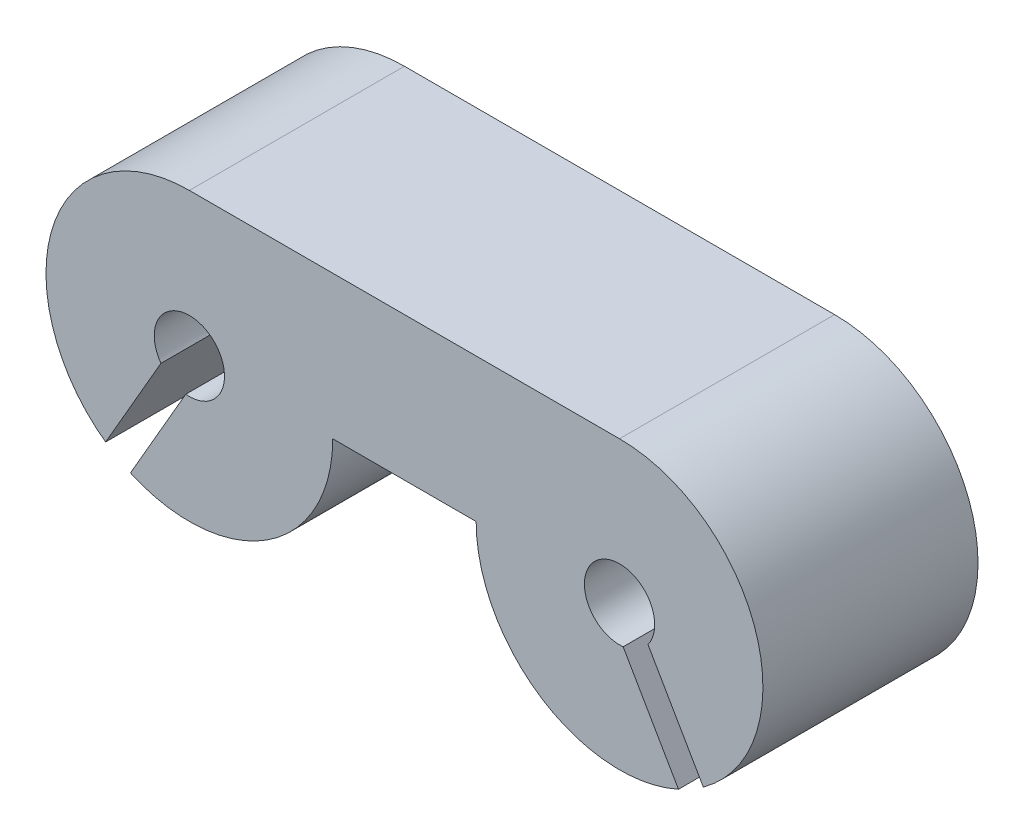
from build123d import *

# Parameters (mm, degrees)
BOSS_EXTRUDE1_DEPTH = 15
SKETCH3_R           = 2.45
CUT_EXTRUDE1_DEPTH  = 31.822070015
CUT_EXTRUDE2_DEPTH  = 31.822070015


with BuildPart() as part:
    # Sketch2 → Boss-Extrude1 (new body)
    with BuildSketch(Plane.XY):
        with BuildLine():
            Line((-5, 10), (-15, 10))
            ThreePointArc((-15, 10), (-22.071067812, -7.071067812), (-5, 0))
            Line((-5, 0), (5, 0))
            ThreePointArc((5, 0), (22.071067812, -7.071067812), (15, 10))
            Line((15, 10), (5, 10))
            Line((5, 10), (-5, 10))
        make_face()
    extrude(amount=BOSS_EXTRUDE1_DEPTH)

    # Sketch3 → Cut-Extrude1 (cut, through all)
    with BuildSketch(Plane.XY.offset(15)):
        with Locations((-15, 0)):
            Circle(SKETCH3_R)
        with Locations((15, 0)):
            Circle(SKETCH3_R)
    extrude(amount=-CUT_EXTRUDE1_DEPTH, mode=Mode.SUBTRACT)

    # Sketch4 → Cut-Extrude2 (cut, through all)
    with BuildSketch(Plane.XY.offset(15)):
        Polygon((-14.133974596, -0.5), (-15.866025404, 0.5), (-20.866025404, -8.160254038), (-19.133974596, -9.160254038), align=None)
        Polygon((14.133974596, -0.5), (15.866025404, 0.5), (20.866025404, -8.160254038), (19.133974596, -9.160254038), align=None)
    extrude(amount=-CUT_EXTRUDE2_DEPTH, mode=Mode.SUBTRACT)


solid = part.part
